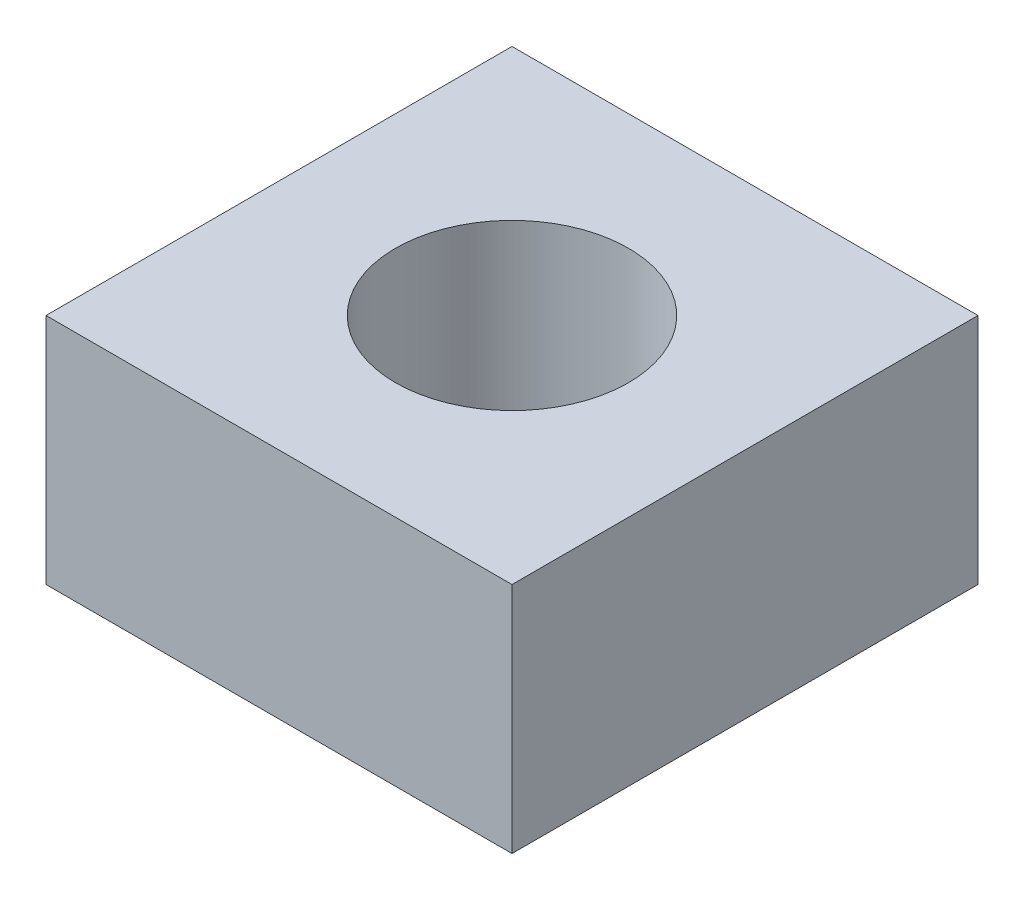
from build123d import *

# Parameters (mm, degrees)
SKETCH1_W           = 20
SKETCH1_H           = 20
SKETCH1_R           = 5
BOSS_EXTRUDE1_DEPTH = 10


with BuildPart() as part:
    # Sketch1 → Boss-Extrude1 (new body)
    with BuildSketch(Plane(origin=(0, 0, 0), x_dir=(1, 0, 0), z_dir=(0, 1, 0))):
        Rectangle(SKETCH1_W, SKETCH1_H)
        with Locations(Location((0, 0, 0), (0, 0, 270))):
            Circle(SKETCH1_R, mode=Mode.SUBTRACT)
    extrude(amount=BOSS_EXTRUDE1_DEPTH)


solid = part.part
